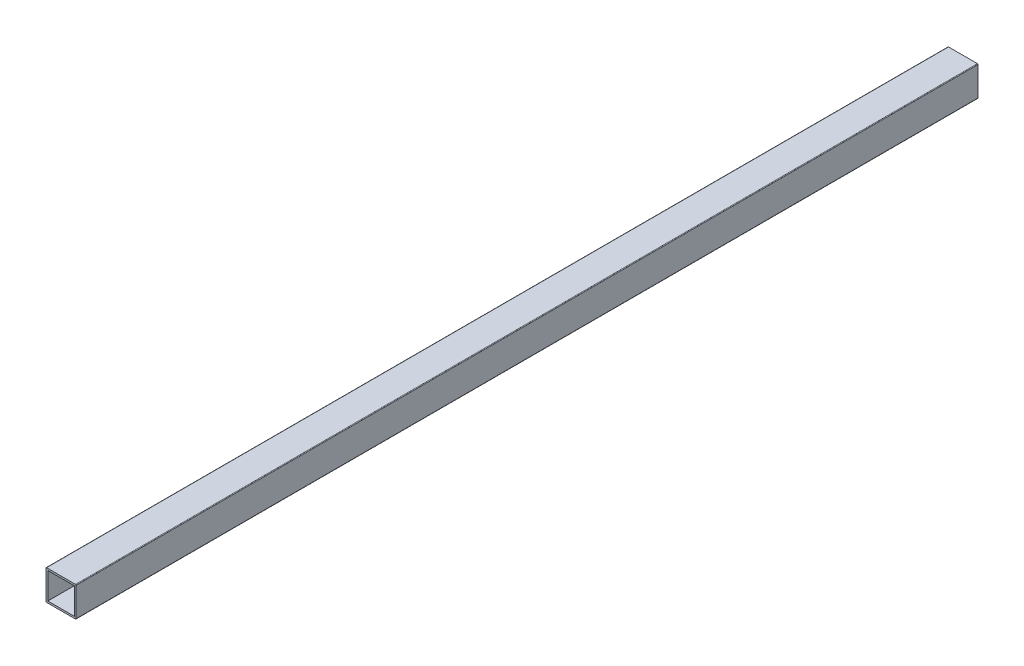
from build123d import *

# Parameters (mm, degrees)
ESBO_O1_W                = 44
ESBO_O1_H                = 44
RESSALTO_EXTRUS_O1_DEPTH = 1500


with BuildPart() as part:
    # Esboço1 → Ressalto-extrusão1 (new body)
    with BuildSketch(Plane.XY):
        with BuildLine():
            Line((24, 25), (-24, 25))
            ThreePointArc((-24, 25), (-24.707106781, 24.707106781), (-25, 24))
            Line((-25, 24), (-25, -24))
            ThreePointArc((-25, -24), (-24.707106781, -24.707106781), (-24, -25))
            Line((-24, -25), (24, -25))
            ThreePointArc((24, -25), (24.707106781, -24.707106781), (25, -24))
            Line((25, -24), (25, 24))
            ThreePointArc((25, 24), (24.707106781, 24.707106781), (24, 25))
        make_face()
        Rectangle(ESBO_O1_W, ESBO_O1_H, mode=Mode.SUBTRACT)
    extrude(amount=RESSALTO_EXTRUS_O1_DEPTH)


solid = part.part
